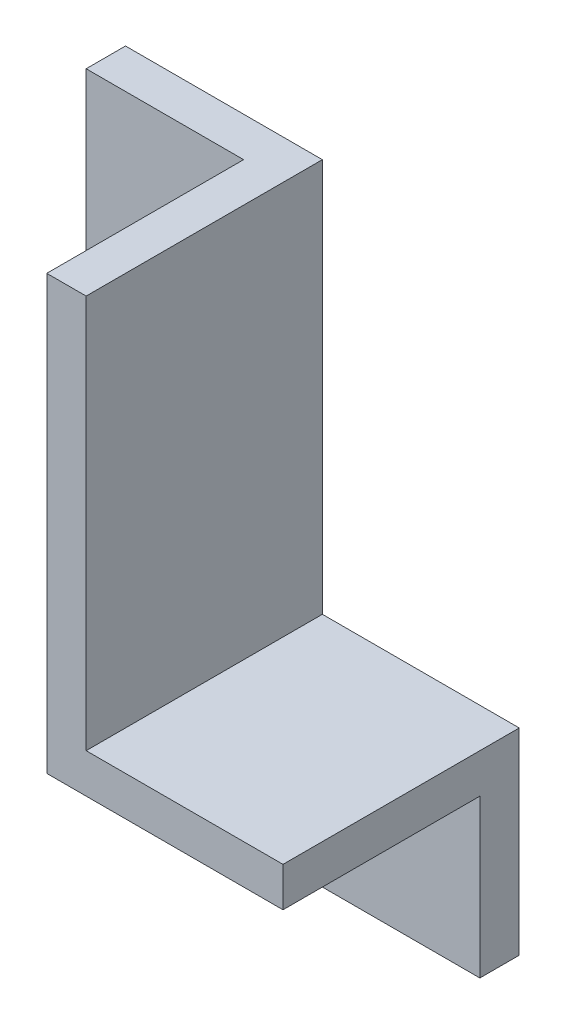
from build123d import *

# Parameters (mm, degrees)
BOSS_EXTRUDE1_DEPTH = 10
BOSS_EXTRUDE2_DEPTH = 50


with BuildPart() as part:
    # Sketch1 → Boss-Extrude1 (new body)
    with BuildSketch(Plane.XY):
        Polygon((0, 150), (50, 150), (50, 50), (100, 50), (100, 0), (0, 0), align=None)
    extrude(amount=BOSS_EXTRUDE1_DEPTH)

    # Sketch2 → Boss-Extrude2 (add)
    with BuildSketch(Plane.XY.offset(10)):
        Polygon((40, 150), (40, 40), (100, 40), (100, 50), (50, 50), (50, 150), align=None)
    extrude(amount=BOSS_EXTRUDE2_DEPTH)


solid = part.part
